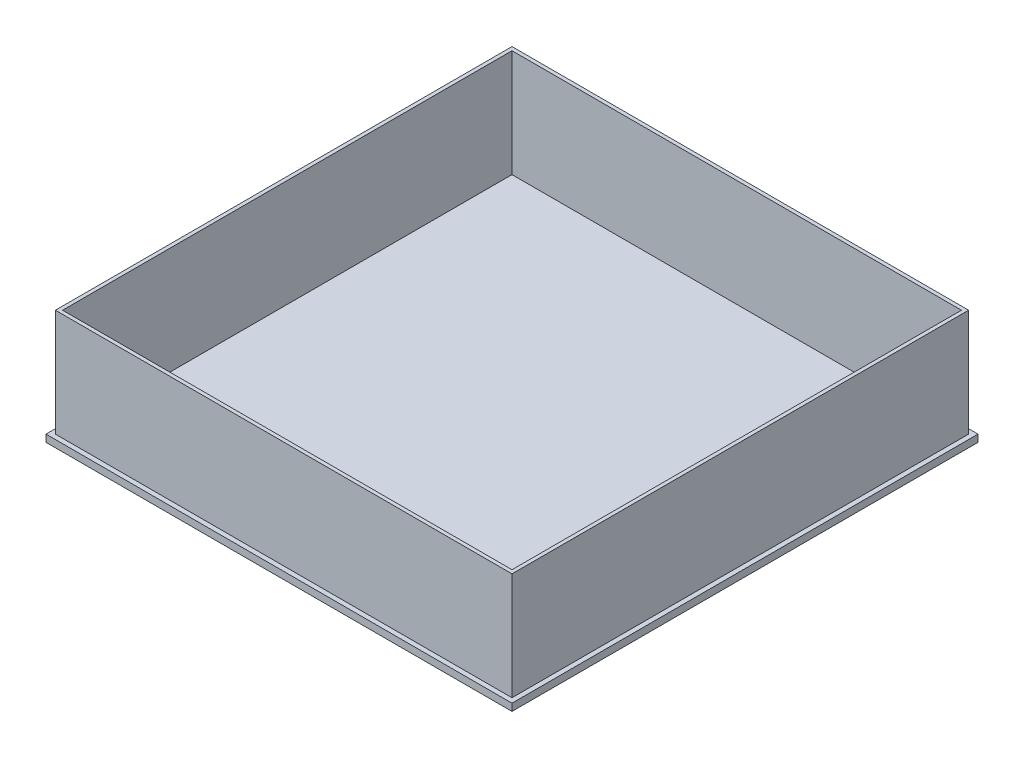
from build123d import *

# Parameters (mm, degrees)
SKETCH_2_W      = 130.27170599
SKETCH_2_H      = 130.27170599
EXTRUDE_1_DEPTH = 2
SKETCH_3_W      = 127.648377196
SKETCH_3_H      = 127.648377196
SKETCH_3_W_2    = 125.648377196
SKETCH_3_H_2    = 125.648377196
EXTRUDE_2_DEPTH = 30


with BuildPart() as part:
    # 草图2 → 凸台-拉伸1 (new body)
    with BuildSketch(Plane(origin=(0, 0, 0), x_dir=(1, 0, 0), z_dir=(0, 1, 0))):
        Rectangle(SKETCH_2_W, SKETCH_2_H)
    extrude(amount=EXTRUDE_1_DEPTH)

    # 草图3 → 凸台-拉伸2 (add)
    with BuildSketch(Plane(origin=(0, 2, 0), x_dir=(1, 0, 0), z_dir=(0, 1, 0))):
        Rectangle(SKETCH_3_W, SKETCH_3_H)
        Rectangle(SKETCH_3_W_2, SKETCH_3_H_2, mode=Mode.SUBTRACT)
    extrude(amount=EXTRUDE_2_DEPTH)


solid = part.part
